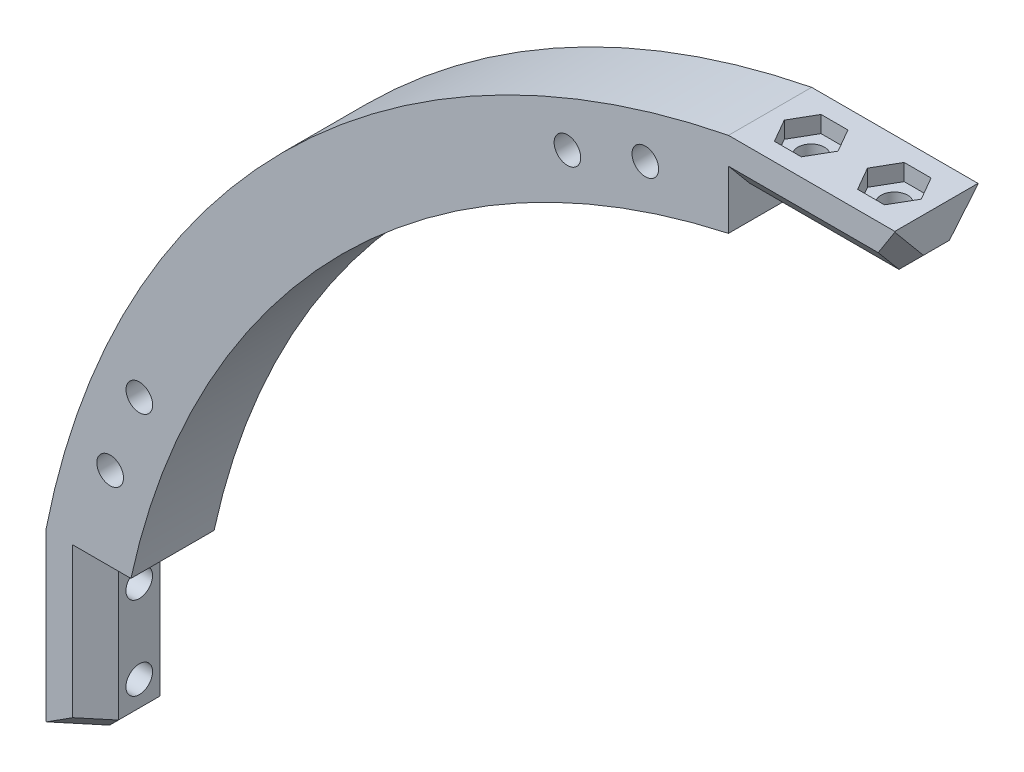
from build123d import *

# Parameters (mm, degrees)
BOSS_EXTRU_1_DEPTH      = 10
ENL_V_MAT_EXTRU_1_DEPTH = 20
ENL_V_MAT_EXTRU_2_DEPTH = 20
ESQUISSE5_R             = 1.6
ENL_V_MAT_EXTRU_3_DEPTH = 20
ESQUISSE6_R             = 1.6
ENL_V_MAT_EXTRU_4_DEPTH = 20
CHANFREIN1_SIZE         = 2
ENL_V_MAT_EXTRU_5_DEPTH = 2
ENL_V_MAT_EXTRU_6_DEPTH = 2
ESQUISSE9_R             = 1.6
ENL_V_MAT_EXTRU_7_DEPTH = 10


with BuildPart() as part:
    # Esquisse1 → Boss.-Extru.1 (new body)
    with BuildSketch(Plane.XY):
        with BuildLine():
            Line((-20, 102.058806577), (0, 102.058806577))
            Line((0, 102.058806577), (0, 91.847700026))
            Line((0, 91.847700026), (-20, 91.847700026))
            ThreePointArc((-20, 91.847700026), (-66.468037432, 66.468037432), (-91.847700026, 20))
            Line((-91.847700026, 20), (-91.847700026, 0))
            Line((-91.847700026, 0), (-102.058806577, 0))
            Line((-102.058806577, 0), (-102.058806577, 20))
            ThreePointArc((-102.058806577, 20), (-73.539105243, 73.539105243), (-20, 102.058806577))
        make_face()
    extrude(amount=BOSS_EXTRU_1_DEPTH)

    # Esquisse2 → Enlèv. mat.-Extru.1 (cut)
    with BuildSketch(Plane.XZ):
        Polygon((-98.847700026, 10), (-91.847700026, 10), (-91.847700026, 0), (-98.847700026, 0), (-95.847700026, 2.5), (-95.847700026, 7.5), align=None)
    extrude(amount=-ENL_V_MAT_EXTRU_1_DEPTH, mode=Mode.SUBTRACT)

    # Esquisse4 → Enlèv. mat.-Extru.2 (cut)
    with BuildSketch(Plane(origin=(0, 0, 0), x_dir=(0, 0, -1), z_dir=(1, 0, 0))):
        Polygon((0, 98.847700026), (0, 91.847700026), (-10, 91.847700026), (-10, 98.847700026), (-7.5, 95.847700026), (-2.5, 95.847700026), align=None)
    extrude(amount=-ENL_V_MAT_EXTRU_2_DEPTH, mode=Mode.SUBTRACT)

    # Esquisse5 → Enlèv. mat.-Extru.3 (cut)
    with BuildSketch(Plane(origin=(-95.847700026, 0, 0), x_dir=(0, 0, -1), z_dir=(1, 0, 0))):
        with Locations(Location((-5, 5, 0), (0, 0, 90))):
            Circle(ESQUISSE5_R)
        with Locations(Location((-5, 15, 0), (0, 0, 90))):
            Circle(ESQUISSE5_R)
    extrude(amount=-ENL_V_MAT_EXTRU_3_DEPTH, mode=Mode.SUBTRACT)

    # Esquisse6 → Enlèv. mat.-Extru.4 (cut)
    with BuildSketch(Plane.XZ.offset(-95.847700026)):
        with Locations(Location((-5, 5.05896145, 0), (0, 0, 270))):
            Circle(ESQUISSE6_R)
        with Locations(Location((-15, 5.05896145, 0), (0, 0, 270))):
            Circle(ESQUISSE6_R)
    extrude(amount=-ENL_V_MAT_EXTRU_4_DEPTH, mode=Mode.SUBTRACT)

    # Chanfrein1
    chanfrein1_edges = [part.edges().sort_by_distance(p)[0] for p in [
        (-97.347700026, 0, 8.75),
        (-95.847700026, 0, 5),
        (-97.347700026, 0, 1.25),
        (0, 97.347700026, 1.25),
        (0, 95.847700026, 5),
        (0, 97.347700026, 8.75),
    ]]
    chamfer(chanfrein1_edges, length=CHANFREIN1_SIZE)

    # Esquisse7 → Enlèv. mat.-Extru.5 (cut)
    with BuildSketch(Plane.ZY.offset(102.058806577)):
        Polygon((2.2, 6.616580754), (2.2, 3.383419246), (5, 1.766838493), (7.8, 3.383419246), (7.8, 6.616580754), (5, 8.233161507), align=None)
        Polygon((7.8, 16.616580754), (5, 18.233161507), (2.2, 16.616580754), (2.2, 13.383419246), (5, 11.766838493), (7.8, 13.383419246), align=None)
    extrude(amount=-ENL_V_MAT_EXTRU_5_DEPTH, mode=Mode.SUBTRACT)

    # Esquisse8 → Enlèv. mat.-Extru.6 (cut)
    with BuildSketch(Plane(origin=(0, 102.058806577, 0), x_dir=(1, 0, 0), z_dir=(0, 1, 0))):
        Polygon((-3.383419246, -2.25896145), (-6.616580754, -2.25896145), (-8.233161507, -5.05896145), (-6.616580754, -7.85896145), (-3.383419246, -7.85896145), (-1.766838493, -5.05896145), align=None)
        Polygon((-13.383419246, -2.25896145), (-16.616580754, -2.25896145), (-18.233161507, -5.05896145), (-16.616580754, -7.85896145), (-13.383419246, -7.85896145), (-11.766838493, -5.05896145), align=None)
    extrude(amount=-ENL_V_MAT_EXTRU_6_DEPTH, mode=Mode.SUBTRACT)

    # Esquisse9 → Enlèv. mat.-Extru.7 (cut)
    with BuildSketch(Plane(origin=(0, 0, 0), x_dir=(-1, 0, 0), z_dir=(0, 0, -1))):
        with Locations((94.345111161, 30)):
            Circle(ESQUISSE9_R)
        with Locations((90.837371891, 39.364601711)):
            Circle(ESQUISSE9_R)
        with Locations((30, 94.345111161)):
            Circle(ESQUISSE9_R)
        with Locations((39.364601711, 90.837371891)):
            Circle(ESQUISSE9_R)
    extrude(amount=-ENL_V_MAT_EXTRU_7_DEPTH, mode=Mode.SUBTRACT)


solid = part.part
